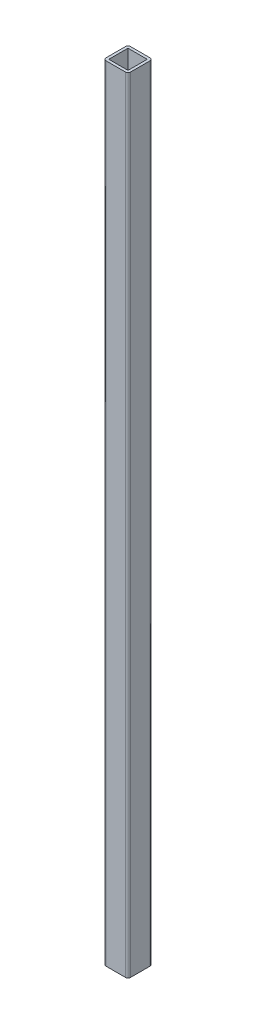
from build123d import *

# Parameters (mm, degrees)
BOSS_EXTRUDE1_DEPTH = 816
SKETCH3_W           = 20
SKETCH3_H           = 20
CUT_EXTRUDE1_DEPTH  = 816


with BuildPart() as part:
    # Sketch1 → Boss-Extrude1 (new body)
    with BuildSketch(Plane(origin=(0, 0, 0), x_dir=(1, 0, 0), z_dir=(0, 1, 0))):
        with BuildLine():
            Line((2.8, 0), (22.8, 0))
            ThreePointArc((22.8, 0), (24.779898987, -0.820101013), (25.6, -2.8))
            Line((25.6, -2.8), (25.6, -22.8))
            ThreePointArc((25.6, -22.8), (24.779898987, -24.779898987), (22.8, -25.6))
            Line((22.8, -25.6), (2.8, -25.6))
            ThreePointArc((2.8, -25.6), (0.820101013, -24.779898987), (0, -22.8))
            Line((0, -22.8), (0, -2.8))
            ThreePointArc((0, -2.8), (0.820101013, -0.820101013), (2.8, 0))
        make_face()
    extrude(amount=BOSS_EXTRUDE1_DEPTH)

    # Sketch3 → Cut-Extrude1 (cut)
    with BuildSketch(Plane(origin=(0, 0, 0), x_dir=(-1, 0, 0), z_dir=(0, -1, 0))):
        with Locations((-12.8, -12.8)):
            Rectangle(SKETCH3_W, SKETCH3_H)
    extrude(amount=-CUT_EXTRUDE1_DEPTH, mode=Mode.SUBTRACT)


solid = part.part
